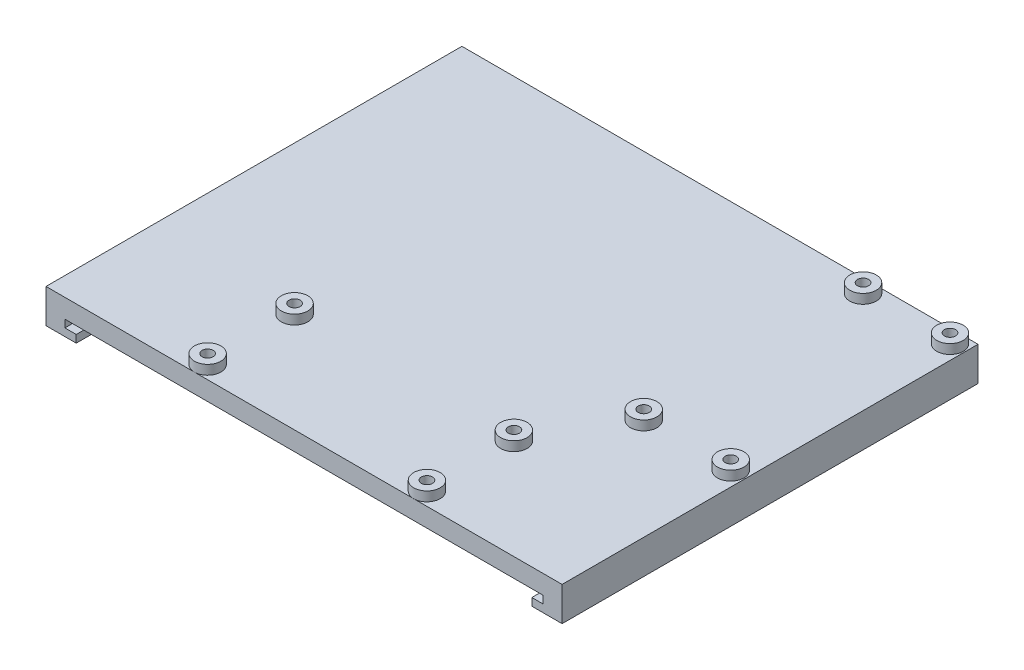
from build123d import *

# Parameters (mm, degrees)
SKETCH1_W           = 136.5
SKETCH1_H           = 110
BOSS_EXTRUDE1_DEPTH = 5
BOSS_EXTRUDE2_DEPTH = 4
BOSS_EXTRUDE3_DEPTH = 2
SKETCH3_R           = 3.5
SKETCH3_R_2         = 1.475
BOSS_EXTRUDE4_DEPTH = 2.5
CUT_EXTRUDE1_START  = -2.5
SKETCH3_6_R         = 1.25
SKETCH3_6_R_2       = 1.475
CUT_EXTRUDE1_DEPTH  = 2.5


with BuildPart() as part:
    # Sketch1 → Boss-Extrude1 (new body)
    with BuildSketch(Plane(origin=(0, 0, 0), x_dir=(1, 0, 0), z_dir=(0, 1, 0))):
        Rectangle(SKETCH1_W, SKETCH1_H)
    extrude(amount=BOSS_EXTRUDE1_DEPTH)

    # Sketch1<4> → Boss-Extrude2 (add)
    with BuildSketch(Plane(origin=(0, 0, 0), x_dir=(1, 0, 0), z_dir=(0, 1, 0))):
        Polygon((63.25, 50), (63.25, -50), (63.25, -55), (68.25, -55), (68.25, 55), (-68.25, 55), (-68.25, -55), (-63.25, -55), (-63.25, -50), (-63.25, 50), align=None)
    extrude(amount=-BOSS_EXTRUDE2_DEPTH)

    # Sketch2 → Boss-Extrude3 (add)
    with BuildSketch(Plane.XZ.offset(4)):
        Polygon((-60.25, 55), (-60.25, -47), (60.25, -47), (60.25, 55), (63.25, 55), (63.25, -50), (-63.25, -50), (-63.25, 55), align=None)
    extrude(amount=-BOSS_EXTRUDE3_DEPTH)

    # Sketch3 → Boss-Extrude4 (add)
    # profile 1 of 8: a face of its own
    with BuildSketch(Plane(origin=(0, 5, 0), x_dir=(1, 0, 0), z_dir=(0, 1, 0))):
        with Locations((29, -51.5)):
            Circle(SKETCH3_R)
        with Locations((29, -51.5)):
            Circle(SKETCH3_R_2, mode=Mode.SUBTRACT)
    # profile 2 of 8: a face of its own
    with BuildSketch(Plane(origin=(0, 5, 0), x_dir=(1, 0, 0), z_dir=(0, 1, 0))):
        with Locations((-29, -51.5)):
            Circle(SKETCH3_R)
        with Locations((-29, -51.5)):
            Circle(SKETCH3_R_2, mode=Mode.SUBTRACT)
    # profile 3 of 8: a face of its own
    with BuildSketch(Plane(origin=(0, 5, 0), x_dir=(1, 0, 0), z_dir=(0, 1, 0))):
        with Locations((29, -28.5)):
            Circle(SKETCH3_R)
        with Locations((29, -28.5)):
            Circle(SKETCH3_R_2, mode=Mode.SUBTRACT)
    # profile 4 of 8: a face of its own
    with BuildSketch(Plane(origin=(0, 5, 0), x_dir=(1, 0, 0), z_dir=(0, 1, 0))):
        with Locations((-29, -28.5)):
            Circle(SKETCH3_R)
        with Locations((-29, -28.5)):
            Circle(SKETCH3_R_2, mode=Mode.SUBTRACT)
    # profile 5 of 8: a face of its own
    with BuildSketch(Plane(origin=(0, 5, 0), x_dir=(1, 0, 0), z_dir=(0, 1, 0))):
        with Locations((64.421406537, 51.425448186)):
            Circle(SKETCH3_R)
        with Locations((64.421406537, 51.425448186)):
            Circle(SKETCH3_R_2, mode=Mode.SUBTRACT)
    # profile 6 of 8: a face of its own
    with BuildSketch(Plane(origin=(0, 5, 0), x_dir=(1, 0, 0), z_dir=(0, 1, 0))):
        with Locations((64.421406537, -6.574551814)):
            Circle(SKETCH3_R)
        with Locations((64.421406537, -6.574551814)):
            Circle(SKETCH3_R_2, mode=Mode.SUBTRACT)
    # profile 7 of 8: a face of its own
    with BuildSketch(Plane(origin=(0, 5, 0), x_dir=(1, 0, 0), z_dir=(0, 1, 0))):
        with Locations((41.421406537, 51.425448186)):
            Circle(SKETCH3_R)
        with Locations((41.421406537, 51.425448186)):
            Circle(SKETCH3_R_2, mode=Mode.SUBTRACT)
    # profile 8 of 8: a face of its own
    with BuildSketch(Plane(origin=(0, 5, 0), x_dir=(1, 0, 0), z_dir=(0, 1, 0))):
        with Locations((41.421406537, -6.574551814)):
            Circle(SKETCH3_R)
        with Locations((41.421406537, -6.574551814)):
            Circle(SKETCH3_R_2, mode=Mode.SUBTRACT)
    extrude(amount=BOSS_EXTRUDE4_DEPTH)

    # Sketch3<6> → Cut-Extrude1 (cut)
    # profile 1 of 5: a face of its own
    with BuildSketch(Plane(origin=(0, 5, 0), x_dir=(1, 0, 0), z_dir=(0, 1, 0)).offset(CUT_EXTRUDE1_START)):
        with Locations((-29, -51.5)):
            Circle(SKETCH3_6_R)
    # profile 2 of 5: a face of its own
    with BuildSketch(Plane(origin=(0, 5, 0), x_dir=(1, 0, 0), z_dir=(0, 1, 0)).offset(CUT_EXTRUDE1_START)):
        with Locations((-29, -28.5)):
            Circle(SKETCH3_6_R)
    # profile 3 of 5: a face of its own
    with BuildSketch(Plane(origin=(0, 5, 0), x_dir=(1, 0, 0), z_dir=(0, 1, 0)).offset(CUT_EXTRUDE1_START)):
        with Locations((29, -28.5)):
            Circle(SKETCH3_6_R)
    # profile 4 of 5: a face of its own
    with BuildSketch(Plane(origin=(0, 5, 0), x_dir=(1, 0, 0), z_dir=(0, 1, 0)).offset(CUT_EXTRUDE1_START)):
        with Locations((29, -51.5)):
            Circle(SKETCH3_6_R)
    # profile 5 of 5: a face of its own
    with BuildSketch(Plane(origin=(0, 5, 0), x_dir=(1, 0, 0), z_dir=(0, 1, 0)).offset(CUT_EXTRUDE1_START)):
        with Locations((64.421406537, 51.425448186)):
            Circle(SKETCH3_6_R_2)
        with Locations((64.421406537, 51.425448186)):
            Circle(SKETCH3_6_R, mode=Mode.SUBTRACT)
    extrude(amount=CUT_EXTRUDE1_DEPTH, mode=Mode.SUBTRACT)


solid = part.part
